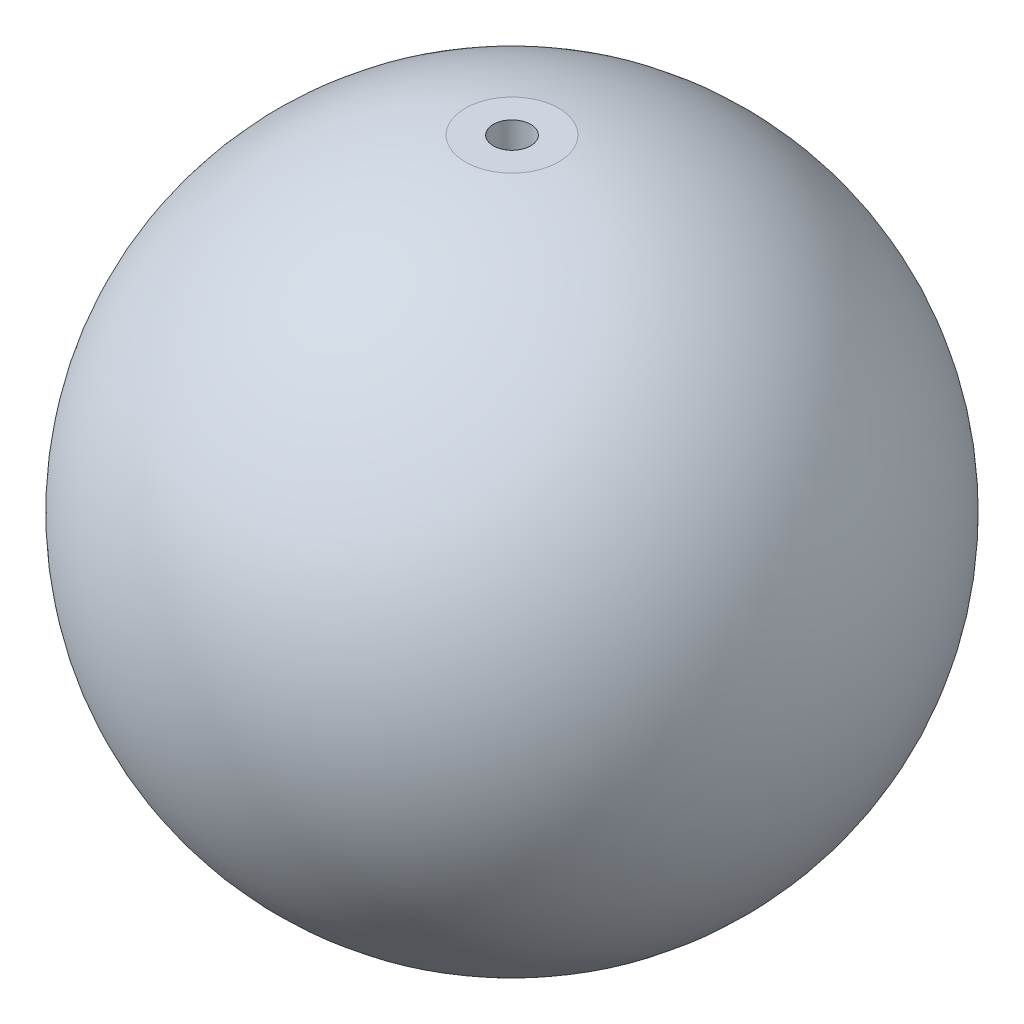
from build123d import *


with BuildPart() as part:
    # Esquisse1 → Révolution1 (revolve)
    with BuildSketch(Plane.XY):
        with BuildLine():
            Line((-2, 0), (-5, 0))
            ThreePointArc((-5, 0), (-35.355339059, 35), (-5, 70))
            Line((-5, 70), (-2, 70))
            Line((-2, 70), (-2, 0))
        make_face()
        with BuildLine():
            Line((-5, 3.033330395), (-5, 66.966669605))
            ThreePointArc((-5, 66.966669605), (-32.355339059, 35), (-5, 3.033330395))
        make_face(mode=Mode.SUBTRACT)
    revolve(axis=Axis((0, 0, 0), (0, 1, 0)))


solid = part.part
